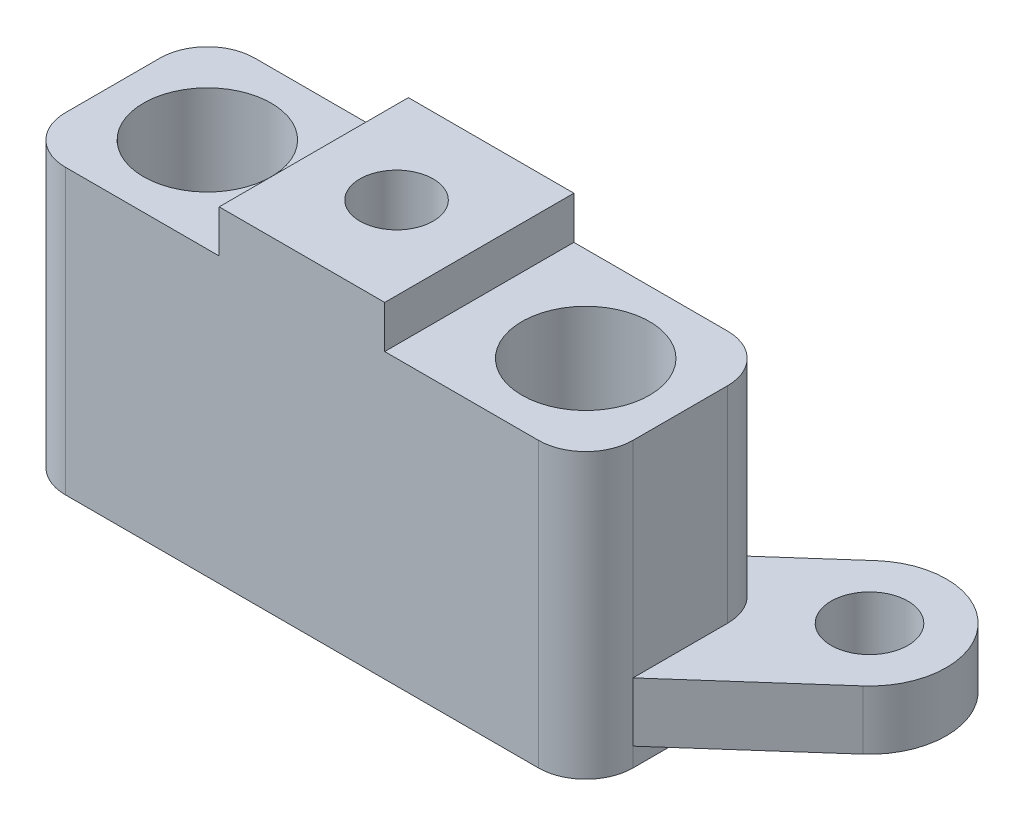
from build123d import *

# Parameters (mm, degrees)
SKETCH25_W          = 7
SKETCH25_H          = 8
BOSS_EXTRUDE5_DEPTH = 13.8
SKETCH26_W          = 24
SKETCH26_H          = 8
SKETCH26_R          = 2.7
BOSS_EXTRUDE6_DEPTH = 12
FILLET1_R           = 2
SKETCH27_R          = 1.55
CUT_EXTRUDE1_DEPTH  = 6.5
SKETCH29_R          = 1.625
BOSS_EXTRUDE8_DEPTH = 2.5


with BuildPart() as part:
    # Sketch25 → Boss-Extrude5 (new body)
    with BuildSketch(Plane(origin=(0, 0, 0), x_dir=(-1, 0, 0), z_dir=(0, 1, 0))):
        Rectangle(SKETCH25_W, SKETCH25_H)
    extrude(amount=BOSS_EXTRUDE5_DEPTH)

    # Sketch26 → Boss-Extrude6 (add)
    with BuildSketch(Plane(origin=(0, 0, 0), x_dir=(-1, 0, 0), z_dir=(0, 1, 0))):
        Rectangle(SKETCH26_W, SKETCH26_H)
        with Locations((-8, 0)):
            Circle(SKETCH26_R, mode=Mode.SUBTRACT)
        with Locations((8, 0)):
            Circle(SKETCH26_R, mode=Mode.SUBTRACT)
    extrude(amount=BOSS_EXTRUDE6_DEPTH)

    # Fillet1
    fillet1_edges = [part.edges().sort_by_distance(p)[0] for p in [
        (12, 6, -4),
        (-12, 6, -4),
        (-12, 6, 4),
        (12, 6, 4),
    ]]
    fillet(fillet1_edges, radius=FILLET1_R)

    # Sketch27 → Cut-Extrude1 (cut)
    with BuildSketch(Plane(origin=(0, 13.8, 0), x_dir=(1, 0, 0), z_dir=(0, 1, 0))):
        Circle(SKETCH27_R)
    extrude(amount=-CUT_EXTRUDE1_DEPTH, mode=Mode.SUBTRACT)

    # Sketch29 → Boss-Extrude8 (add)
    # profile 1 of 2: a face of its own
    with BuildSketch(Plane.XZ.offset(-0.8)):
        with BuildLine():
            Line((-17.155221844, -2.567404924), (-12, 2))
            Line((-12, 2), (-11, -3))
            Line((-11, -3), (-8.970414177, -4))
            Line((-8.970414177, -4), (-12.844778156, -7.432595076))
            ThreePointArc((-12.844778156, -7.432595076), (-17.432595076, -7.155221844), (-17.155221844, -2.567404924))
        make_face()
        with Locations((-15, -5)):
            Circle(SKETCH29_R, mode=Mode.SUBTRACT)
    # profile 2 of 2: a face of its own
    with BuildSketch(Plane.XZ.offset(-0.8)):
        with BuildLine():
            Line((17.155221844, -2.567404924), (12, 2))
            Line((12, 2), (11, -3))
            Line((11, -3), (8.970414177, -4))
            Line((8.970414177, -4), (12.844778156, -7.432595076))
            ThreePointArc((12.844778156, -7.432595076), (17.432595076, -7.155221844), (17.155221844, -2.567404924))
        make_face()
        with Locations((15, -5)):
            Circle(SKETCH29_R, mode=Mode.SUBTRACT)
    extrude(amount=-BOSS_EXTRUDE8_DEPTH)


solid = part.part
